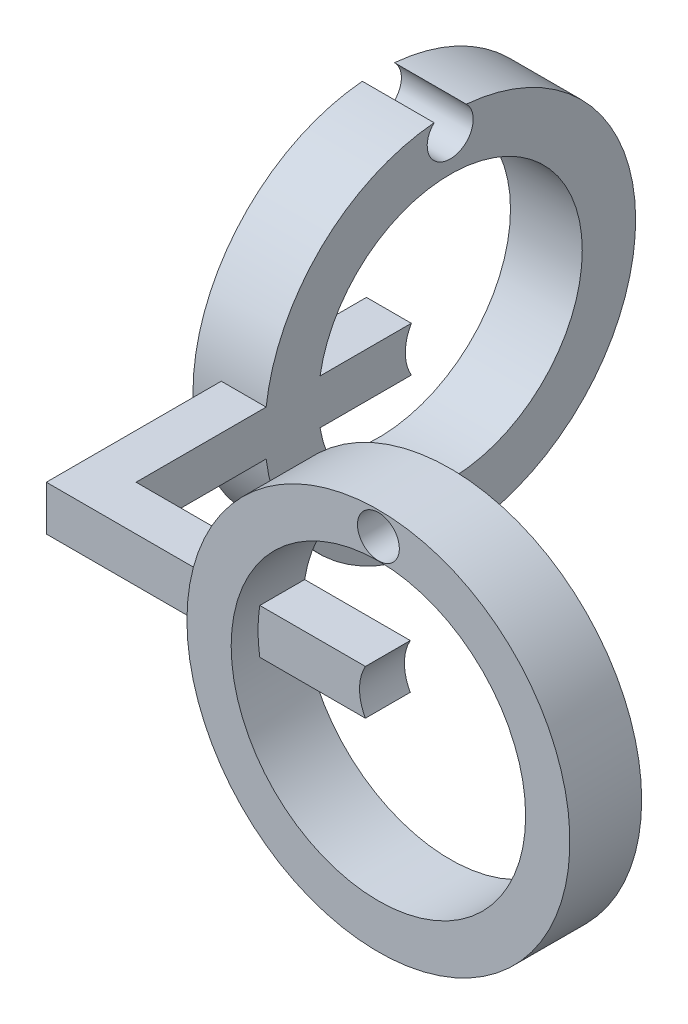
from build123d import *

# Parameters (mm, degrees)
BOSS_EXTRUDE1_DEPTH = 10
SKETCH3_R           = 5
BOSS_EXTRUDE2_DEPTH = 5
SKETCH4_W           = 12.842437823
SKETCH4_H           = 1
CUT_EXTRUDE1_DEPTH  = 5
SKETCH5_R           = 3.418084762
BOSS_EXTRUDE3_DEPTH = 5
SKETCH6_W           = 9.346993936
SKETCH6_H           = 1
CUT_EXTRUDE2_DEPTH  = 5
SKETCH7_R           = 42.668113091
SKETCH7_R_2         = 32.812087574
BOSS_EXTRUDE4_DEPTH = 16
SKETCH8_R           = 10.204262611
CUT_EXTRUDE3_DEPTH  = 16
SKETCH9_R           = 41.320841223
SKETCH9_R_2         = 29.431774833
BOSS_EXTRUDE5_DEPTH = 16
SKETCH10_R          = 10.002103031
CUT_EXTRUDE4_DEPTH  = 16
SKETCH11_R          = 5.125485485
CUT_EXTRUDE5_DEPTH  = 16
SKETCH12_R          = 4.662079799
CUT_EXTRUDE6_DEPTH  = 16


with BuildPart() as part:
    # Sketch1 → Boss-Extrude1 (new body)
    with BuildSketch(Plane(origin=(0, 0, 0), x_dir=(1, 0, 0), z_dir=(0, 1, 0))):
        Polygon((0, 0), (0, 70), (-10, 70), (-10, -10), (70, -10), (70, 0), align=None)
    extrude(amount=BOSS_EXTRUDE1_DEPTH)

    # Sketch3 → Boss-Extrude2 (add)
    with BuildSketch(Plane.XY.offset(10)):
        with Locations((65, 5)):
            Circle(SKETCH3_R)
    extrude(amount=BOSS_EXTRUDE2_DEPTH)

    # Sketch4 → Cut-Extrude1 (cut)
    with BuildSketch(Plane.XY.offset(15)):
        with Locations((61.851491479, 5)):
            Rectangle(SKETCH4_W, SKETCH4_H)
    extrude(amount=-CUT_EXTRUDE1_DEPTH, mode=Mode.SUBTRACT)

    # Sketch5 → Boss-Extrude3 (add)
    with BuildSketch(Plane.ZY.offset(10)):
        with Locations(Location((-44.354632579, 5, 0), (0, 0, 180))):
            Circle(SKETCH5_R)
    extrude(amount=BOSS_EXTRUDE3_DEPTH)

    # Sketch6 → Cut-Extrude2 (cut)
    with BuildSketch(Plane.ZY.offset(15)):
        with Locations((-49.962828941, 2.5)):
            Rectangle(SKETCH6_W, SKETCH6_H)
    extrude(amount=-CUT_EXTRUDE2_DEPTH, mode=Mode.SUBTRACT)

    # Sketch7 → Boss-Extrude4 (add)
    with BuildSketch(Plane(origin=(0, 0, 0), x_dir=(-1, 0, 0), z_dir=(0, 0, -1))):
        with Locations((-70, 5)):
            Circle(SKETCH7_R)
        with Locations((-70, 5)):
            Circle(SKETCH7_R_2, mode=Mode.SUBTRACT)
    extrude(amount=-BOSS_EXTRUDE4_DEPTH)

    # Sketch8 → Cut-Extrude3 (cut)
    with BuildSketch(Plane(origin=(0, 0, 0), x_dir=(-1, 0, 0), z_dir=(0, 0, -1))):
        with Locations((-70, 5)):
            Circle(SKETCH8_R)
    extrude(amount=-CUT_EXTRUDE3_DEPTH, mode=Mode.SUBTRACT)

    # Sketch9 → Boss-Extrude5 (add)
    with BuildSketch(Plane(origin=(0, 0, 0), x_dir=(0, 0, -1), z_dir=(1, 0, 0))):
        with Locations((70, 5)):
            Circle(SKETCH9_R)
        with Locations((70, 5)):
            Circle(SKETCH9_R_2, mode=Mode.SUBTRACT)
    extrude(amount=-BOSS_EXTRUDE5_DEPTH)

    # Sketch10 → Cut-Extrude4 (cut)
    with BuildSketch(Plane(origin=(0, 0, 0), x_dir=(0, 0, -1), z_dir=(1, 0, 0))):
        with Locations((70, 5)):
            Circle(SKETCH10_R)
    extrude(amount=-CUT_EXTRUDE4_DEPTH, mode=Mode.SUBTRACT)

    # Sketch11 → Cut-Extrude5 (cut)
    with BuildSketch(Plane(origin=(0, 0, 0), x_dir=(0, 0, -1), z_dir=(1, 0, 0))):
        with Locations((70, 42.5)):
            Circle(SKETCH11_R)
    extrude(amount=-CUT_EXTRUDE5_DEPTH, mode=Mode.SUBTRACT)

    # Sketch12 → Cut-Extrude6 (cut)
    with BuildSketch(Plane(origin=(0, 0, 0), x_dir=(-1, 0, 0), z_dir=(0, 0, -1))):
        with Locations((-70, 42.5)):
            Circle(SKETCH12_R)
    extrude(amount=-CUT_EXTRUDE6_DEPTH, mode=Mode.SUBTRACT)


solid = part.part
